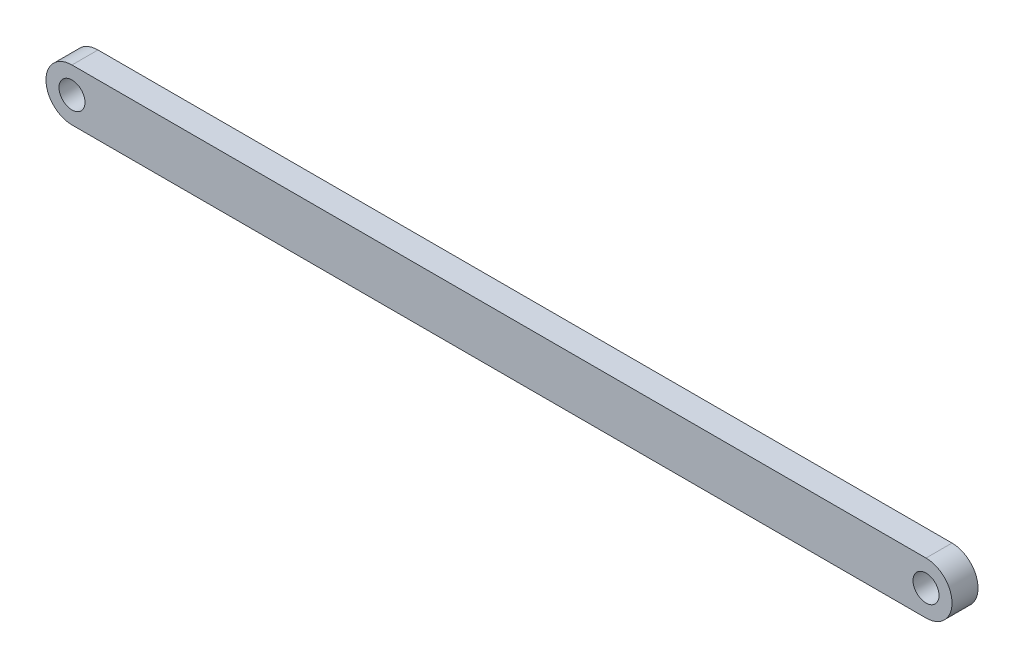
from build123d import *

# Parameters (mm, degrees)
ESBO_O2_R                = 2.5
RESSALTO_EXTRUS_O1_DEPTH = 5


with BuildPart() as part:
    # Esboço2 → Ressalto-extrusão1 (new body)
    with BuildSketch(Plane.XY):
        with BuildLine():
            Line((-82.16, 7.061519582), (82.16, 7.061519582))
            ThreePointArc((82.16, 7.061519582), (87.16, 2.061519582), (82.16, -2.938480418))
            Line((82.16, -2.938480418), (-82.16, -2.938480418))
            ThreePointArc((-82.16, -2.938480418), (-87.16, 2.061519582), (-82.16, 7.061519582))
        make_face()
        with Locations((-82.16, 2.061519582)):
            Circle(ESBO_O2_R, mode=Mode.SUBTRACT)
        with Locations((82.16, 2.061519582)):
            Circle(ESBO_O2_R, mode=Mode.SUBTRACT)
    extrude(amount=RESSALTO_EXTRUS_O1_DEPTH)


solid = part.part
